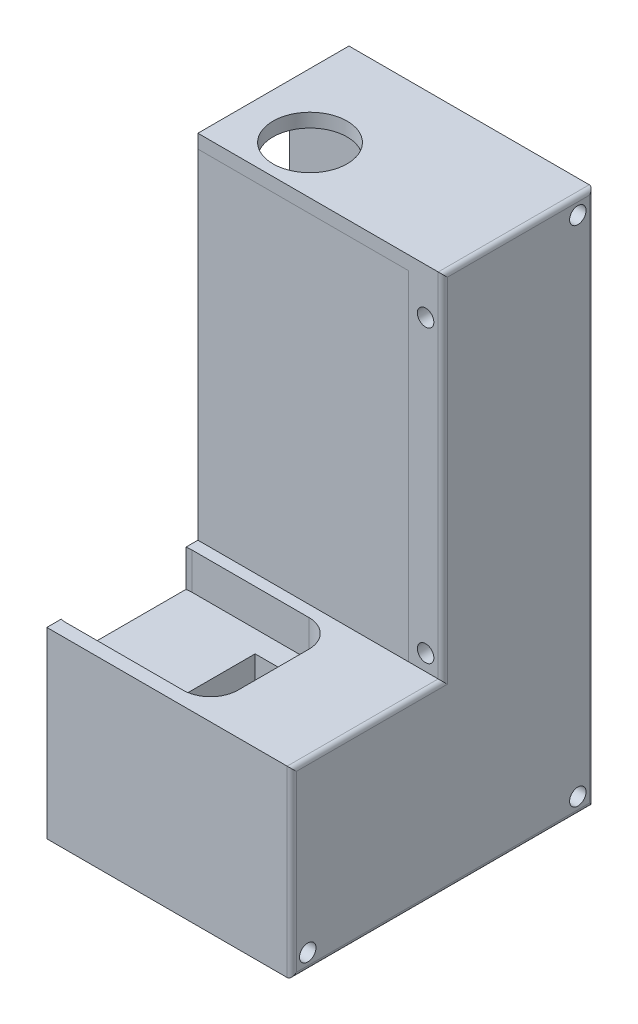
from build123d import *

# Parameters (mm, degrees)
SKETCH_1_W           = 33
SKETCH_1_H           = 25
SKETCH_1_W_2         = 23
SKETCH_1_H_2         = 117
SKETCH_1_W_3         = 10
EXTRUDE_1_DEPTH      = 77
SKETCH_2_W           = 62
SKETCH_2_H           = 62
CUT_EXTRUDE_1_DEPTH  = 10
SKETCH_3_R           = 8.1
CUT_EXTRUDE_2_DEPTH  = 10
SKETCH_4_W           = 62
SKETCH_4_H           = 40
CUT_EXTRUDE_3_DEPTH  = 58.5
SKETCH_5_W           = 77
SKETCH_5_H           = 33
EXTRUDE_2_DEPTH      = 15
EXTRUDE_3_DEPTH      = 7
SKETCH_7_W           = 62
SKETCH_7_H           = 66.5
CUT_EXTRUDE_4_DEPTH  = 20
SKETCH_8_W           = 62
SKETCH_8_H           = 2
EXTRUDE_4_DEPTH      = 89
SKETCH_9_R           = 1.8
CUT_EXTRUDE_5_DEPTH  = 125.426685241
SKETCH_10_R          = 1.8
CUT_EXTRUDE_6_DEPTH  = 125.426685241
SKETCH_12_R          = 1.8
CUT_EXTRUDE_7_DEPTH  = 3
SKETCH_13_W          = 7.5
SKETCH_13_H          = 11.5
CUT_EXTRUDE_8_DEPTH  = 10
EXTRUDE_START        = 2
SKETCH_14_W          = 6.5
SKETCH_14_H          = 6.5
SKETCH_14_R          = 1.8
SKETCH_14_W_2        = 8
SKETCH_14_H_2        = 8
EXTRUDE_6_DEPTH      = 2
CUT_EXTRUDE_9_DEPTH  = 23.5
SKETCH_17_W          = 46
SKETCH_17_H          = 51
CUT_EXTRUDE_11_DEPTH = 4.5
SKETCH_18_W          = 46
SKETCH_18_H          = 17.5
CUT_EXTRUDE_12_DEPTH = 4.5
FILLET_1_R           = 1


with BuildPart() as part:
    # ｽｹｯﾁ1 → ﾎﾞｽ - 押し出し1 (new body)
    with BuildSketch(Plane(origin=(0, 0, 0), x_dir=(0, 0, -1), z_dir=(1, 0, 0))):
        with Locations((-16.5, -12.5)):
            Rectangle(SKETCH_1_W, SKETCH_1_H)
        with Locations((11.5, 33.5)):
            Rectangle(SKETCH_1_W_2, SKETCH_1_H_2)
        with Locations((28, 33.5)):
            Rectangle(SKETCH_1_W_3, SKETCH_1_H_2)
    extrude(amount=EXTRUDE_1_DEPTH)

    # ｽｹｯﾁ2 → ｶｯﾄ - 押し出し1 (cut)
    with BuildSketch(Plane(origin=(0, 0, -33), x_dir=(-1, 0, 0), z_dir=(0, 0, -1))):
        with Locations((-38.5, 53.5)):
            Rectangle(SKETCH_2_W, SKETCH_2_H)
    extrude(amount=-CUT_EXTRUDE_1_DEPTH, mode=Mode.SUBTRACT)

    # ｽｹｯﾁ3 → ｶｯﾄ - 押し出し2 (cut)
    with BuildSketch(Plane(origin=(0, 92, 0), x_dir=(1, 0, 0), z_dir=(0, 1, 0))):
        with Locations(Location((37.5, 10.5, 0), (0, 0, 270))):
            Circle(SKETCH_3_R)
    extrude(amount=-CUT_EXTRUDE_2_DEPTH, mode=Mode.SUBTRACT)

    # ｽｹｯﾁ4 → ｶｯﾄ - 押し出し3 (cut)
    with BuildSketch(Plane(origin=(0, 0, -33), x_dir=(-1, 0, 0), z_dir=(0, 0, -1))):
        with Locations((-38.5, 2.5)):
            Rectangle(SKETCH_4_W, SKETCH_4_H)
    extrude(amount=-CUT_EXTRUDE_3_DEPTH, mode=Mode.SUBTRACT)

    # ｽｹｯﾁ5 → ﾎﾞｽ - 押し出し2 (add)
    with BuildSketch(Plane(origin=(0, 0, 0), x_dir=(1, 0, 0), z_dir=(0, 1, 0))):
        with Locations((38.5, -16.5)):
            Rectangle(SKETCH_5_W, SKETCH_5_H)
        with BuildLine():
            Line((50.25, -2.5), (24.75, -2.5))
            ThreePointArc((24.75, -2.5), (20.507359313, -4.257359313), (18.75, -8.5))
            Line((18.75, -8.5), (18.75, -24))
            ThreePointArc((18.75, -24), (20.507359313, -28.242640687), (24.75, -30))
            Line((24.75, -30), (50.25, -30))
            ThreePointArc((50.25, -30), (54.492640687, -28.242640687), (56.25, -24))
            Line((56.25, -24), (56.25, -8.5))
            ThreePointArc((56.25, -8.5), (54.492640687, -4.257359313), (50.25, -2.5))
        make_face(mode=Mode.SUBTRACT)
    extrude(amount=EXTRUDE_2_DEPTH)

    # ｽｹｯﾁ6 → ﾎﾞｽ - 押し出し3 (add)
    with BuildSketch(Plane(origin=(0, 0, 0), x_dir=(1, 0, 0), z_dir=(0, 1, 0))):
        with BuildLine():
            Line((43.25, -25.5), (43.25, -25.25))
            Line((43.25, -25.25), (43.25, -7.25))
            Line((43.25, -7.25), (43.25, -2.5))
            Line((43.25, -2.5), (24.75, -2.5))
            ThreePointArc((24.75, -2.5), (20.507359313, -4.257359313), (18.75, -8.5))
            Line((18.75, -8.5), (18.75, -24))
            ThreePointArc((18.75, -24), (18.797821822, -24.756025755), (18.940524981, -25.5))
            Line((18.940524981, -25.5), (43.25, -25.5))
        make_face()
        with BuildLine():
            Line((43.25, -30), (43.25, -25.5))
            Line((43.25, -25.5), (18.940524981, -25.5))
            ThreePointArc((18.940524981, -25.5), (21.075765386, -28.74341649), (24.75, -30))
            Line((24.75, -30), (43.25, -30))
        make_face()
        with BuildLine():
            Line((51.25, -25.5), (43.25, -25.5))
            Line((43.25, -25.5), (43.25, -30))
            Line((43.25, -30), (50.25, -30))
            ThreePointArc((50.25, -30), (50.751757562, -29.978983137), (51.25, -29.916079783))
            Line((51.25, -29.916079783), (51.25, -25.5))
        make_face()
        with BuildLine():
            Line((51.25, -7.25), (51.25, -25.25))
            Line((51.25, -25.25), (51.25, -25.5))
            Line((51.25, -25.5), (56.059475019, -25.5))
            ThreePointArc((56.059475019, -25.5), (56.202178178, -24.756025755), (56.25, -24))
            Line((56.25, -24), (56.25, -8.5))
            ThreePointArc((56.25, -8.5), (54.832575695, -4.627016654), (51.25, -2.583920217))
            Line((51.25, -2.583920217), (51.25, -7.25))
        make_face()
        with BuildLine():
            Line((56.059475019, -25.5), (51.25, -25.5))
            Line((51.25, -25.5), (51.25, -29.916079783))
            ThreePointArc((51.25, -29.916079783), (54.308038648, -28.419538701), (56.059475019, -25.5))
        make_face()
        with BuildLine():
            Line((43.25, -2.5), (43.25, -7.25))
            Line((43.25, -7.25), (51.25, -7.25))
            Line((51.25, -7.25), (51.25, -2.583920217))
            ThreePointArc((51.25, -2.583920217), (50.751757562, -2.521016863), (50.25, -2.5))
            Line((50.25, -2.5), (43.25, -2.5))
        make_face()
    extrude(amount=EXTRUDE_3_DEPTH)

    # ｽｹｯﾁ7 → ｶｯﾄ - 押し出し4 (cut)
    with BuildSketch(Plane.XY):
        with Locations((38.5, 55.75)):
            Rectangle(SKETCH_7_W, SKETCH_7_H)
    extrude(amount=-CUT_EXTRUDE_4_DEPTH, mode=Mode.SUBTRACT)

    # ｽｹｯﾁ9 → ｶｯﾄ - 押し出し5 (cut, through all)
    with BuildSketch(Plane.ZY):
        with Locations((-29.5, 88.5)):
            Circle(SKETCH_9_R)
        with Locations((-29.5, -21.5)):
            Circle(SKETCH_9_R)
        with Locations((29.5, -21.5)):
            Circle(SKETCH_9_R)
    extrude(amount=-CUT_EXTRUDE_5_DEPTH, mode=Mode.SUBTRACT)

    # ｽｹｯﾁ10 → ｶｯﾄ - 押し出し6 (cut, through all)
    with BuildSketch(Plane.XY):
        with Locations((3.75, 82)):
            Circle(SKETCH_10_R)
        with Locations((73.25, 82)):
            Circle(SKETCH_10_R)
        with Locations((73.25, 18.5)):
            Circle(SKETCH_10_R)
        with Locations((3.75, 18.5)):
            Circle(SKETCH_10_R)
    extrude(amount=-CUT_EXTRUDE_6_DEPTH, mode=Mode.SUBTRACT)

    # ｽｹｯﾁ12 → ｶｯﾄ - 押し出し7 (cut)
    with BuildSketch(Plane(origin=(0, 0, -23), x_dir=(-1, 0, 0), z_dir=(0, 0, -1))):
        with Locations(Location((-66.5, 81.5, 0), (0, 0, 90))):
            Circle(SKETCH_12_R)
        with Locations(Location((-11.5, 81.5, 0), (0, 0, 90))):
            Circle(SKETCH_12_R)
        with Locations(Location((-11.5, 26.5, 0), (0, 0, 90))):
            Circle(SKETCH_12_R)
        with Locations(Location((-66.5, 26.5, 0), (0, 0, 90))):
            Circle(SKETCH_12_R)
    extrude(amount=-CUT_EXTRUDE_7_DEPTH, mode=Mode.SUBTRACT)

    # ｽｹｯﾁ13 → ｶｯﾄ - 押し出し8 (cut)
    with BuildSketch(Plane(origin=(0, 0, -33), x_dir=(-1, 0, 0), z_dir=(0, 0, -1))):
        with Locations((-3.75, 36.25)):
            Rectangle(SKETCH_13_W, SKETCH_13_H)
    extrude(amount=-CUT_EXTRUDE_8_DEPTH, mode=Mode.SUBTRACT)

    # ｽｹｯﾁ14 → ﾎﾞｽ - 押し出し6 (add)
    # profile 1 of 4: a face of its own
    with BuildSketch(Plane(origin=(0, 0, -23), x_dir=(-1, 0, 0), z_dir=(0, 0, -1)).offset(EXTRUDE_START)):
        with Locations((-66.25, 81.25)):
            Rectangle(SKETCH_14_W, SKETCH_14_H)
        with Locations(Location((-66.5, 81.5, 0), (0, 0, 90))):
            Circle(SKETCH_14_R, mode=Mode.SUBTRACT)
    # profile 2 of 4: a face of its own
    with BuildSketch(Plane(origin=(0, 0, -23), x_dir=(-1, 0, 0), z_dir=(0, 0, -1)).offset(EXTRUDE_START)):
        with Locations((-11.5, 81.25)):
            Rectangle(SKETCH_14_W_2, SKETCH_14_H)
        with Locations(Location((-11.5, 81.5, 0), (0, 0, 90))):
            Circle(SKETCH_14_R, mode=Mode.SUBTRACT)
    # profile 3 of 4: a face of its own
    with BuildSketch(Plane(origin=(0, 0, -23), x_dir=(-1, 0, 0), z_dir=(0, 0, -1)).offset(EXTRUDE_START)):
        with Locations((-11.5, 26.5)):
            Rectangle(SKETCH_14_W_2, SKETCH_14_H_2)
        with Locations(Location((-11.5, 26.5, 0), (0, 0, 90))):
            Circle(SKETCH_14_R, mode=Mode.SUBTRACT)
    # profile 4 of 4: a face of its own
    with BuildSketch(Plane(origin=(0, 0, -23), x_dir=(-1, 0, 0), z_dir=(0, 0, -1)).offset(EXTRUDE_START)):
        with Locations((-66.25, 26.5)):
            Rectangle(SKETCH_14_W, SKETCH_14_H_2)
        with Locations(Location((-66.5, 26.5, 0), (0, 0, 90))):
            Circle(SKETCH_14_R, mode=Mode.SUBTRACT)
    extrude(amount=-EXTRUDE_6_DEPTH)


with BuildPart() as body_2:
    # ｽｹｯﾁ8 → ﾎﾞｽ - 押し出し4 (new body)
    with BuildSketch(Plane(origin=(0, 89, 0), x_dir=(-1, 0, 0), z_dir=(0, -1, 0))):
        with Locations((-38.5, 1)):
            Rectangle(SKETCH_8_W, SKETCH_8_H)
    extrude(amount=EXTRUDE_4_DEPTH)


with BuildPart() as cut_extrude_9_tool:
    # ｽｹｯﾁ15 → ｶｯﾄ - 押し出し9 (new body)
    with BuildSketch(Plane.ZY):
        Polygon((-23, 42), (-23, 30.5), (-33, 30.5), (-33, -25), (33, -25), (33, 15), (0, 15), (0, 92), (-33, 92), (-33, 42), align=None)
    extrude(amount=-CUT_EXTRUDE_9_DEPTH)


with BuildPart() as part_1:
    add(part.part)

    # ｶｯﾄ - 押し出し9: cut by cut_extrude_9_tool
    add(cut_extrude_9_tool.part, mode=Mode.SUBTRACT)

    # ｽｹｯﾁ17 → ｶｯﾄ - 押し出し11 (cut)
    with BuildSketch(Plane(origin=(0, -17.5, 0), x_dir=(1, 0, 0), z_dir=(0, 1, 0))):
        with Locations((46.5, 0)):
            Rectangle(SKETCH_17_W, SKETCH_17_H)
    extrude(amount=-CUT_EXTRUDE_11_DEPTH, mode=Mode.SUBTRACT)

    # ｽｹｯﾁ18 → ｶｯﾄ - 押し出し12 (cut)
    with BuildSketch(Plane(origin=(0, 0, 25.5), x_dir=(-1, 0, 0), z_dir=(0, 0, -1))):
        with Locations((-46.5, -8.75)):
            Rectangle(SKETCH_18_W, SKETCH_18_H)
    extrude(amount=-CUT_EXTRUDE_12_DEPTH, mode=Mode.SUBTRACT)

    # ﾌｨﾚｯﾄ1
    fillet_1_edges = [part_1.edges().sort_by_distance(p)[0] for p in [
        (77, -5, 33),
        (77, -25, 0),
        (77, 33.5, -33),
        (77, 92, -16.5),
        (77, 53.5, 0),
        (77, 15, 16.5),
    ]]
    fillet(fillet_1_edges, radius=FILLET_1_R)


with BuildPart() as body_2_1:
    add(body_2.part)

    # ｶｯﾄ - 押し出し9: cut by cut_extrude_9_tool
    add(cut_extrude_9_tool.part, mode=Mode.SUBTRACT)


solid = Compound([part_1.part, body_2_1.part])
